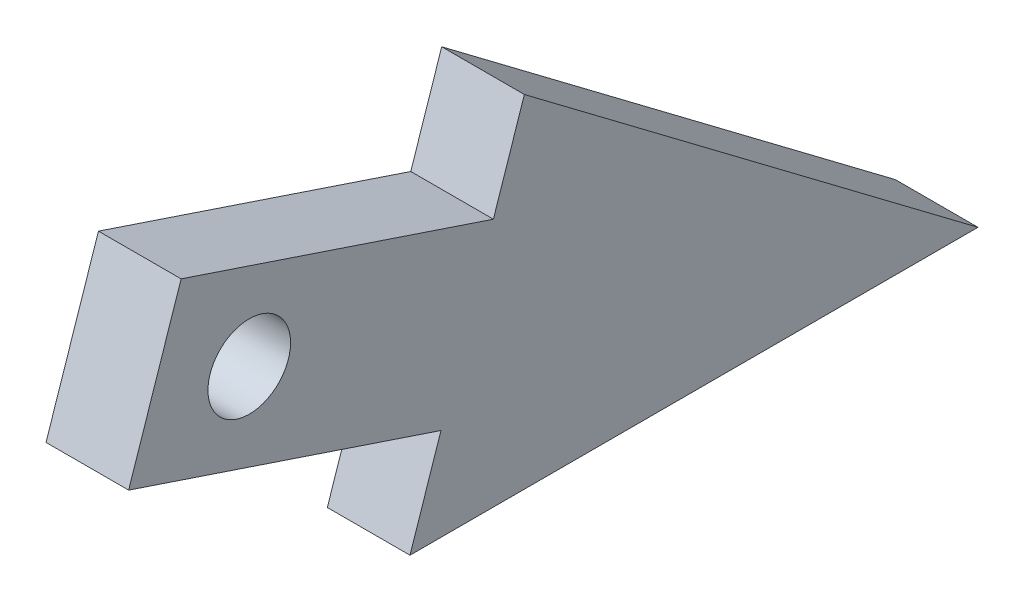
from build123d import *

# Parameters (mm, degrees)
SKETCH2_R           = 12.7
BOSS_EXTRUDE1_DEPTH = 25.4


with BuildPart() as part:
    # Sketch2 → Boss-Extrude1 (new body)
    with BuildSketch(Plane(origin=(0, 0, 0), x_dir=(0, 0, -1), z_dir=(1, 0, 0))):
        Polygon((223.942164258, 0), (49.391117597, 0), (58.905770565, 28.436300252), (-37.061760264, 60.546586891), (-20.942683719, 108.721428576), (75.024847111, 76.611141936), (84.539500079, 105.047442188), align=None)
        with Locations((0, 74.93)):
            Circle(SKETCH2_R, mode=Mode.SUBTRACT)
    extrude(amount=BOSS_EXTRUDE1_DEPTH)


solid = part.part
